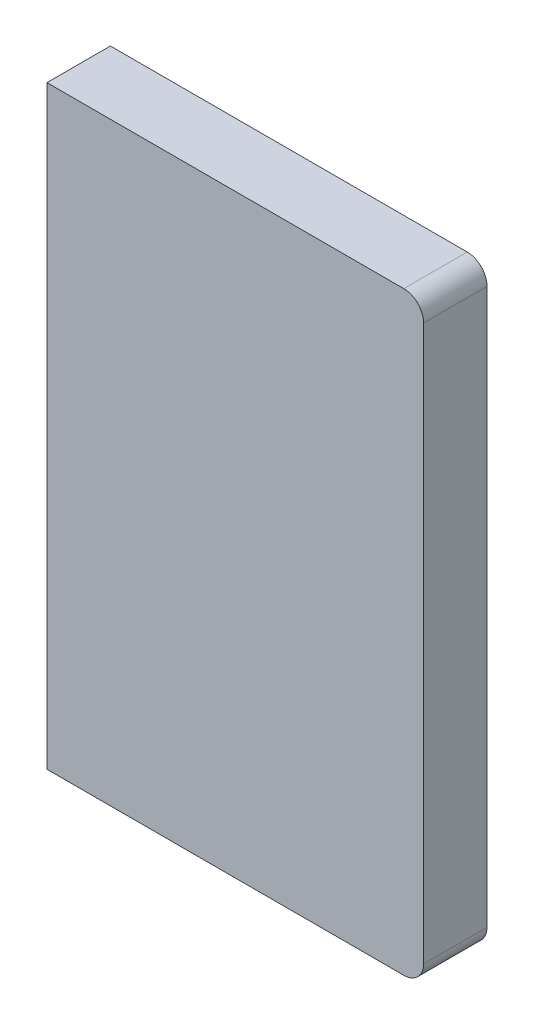
from build123d import *

# Parameters (mm, degrees)
SKETCH1_W           = 95
SKETCH1_H           = 150
BOSS_EXTRUDE1_DEPTH = 16
FILLET1_R           = 5


with BuildPart() as part:
    # Sketch1 → Boss-Extrude1 (new body)
    with BuildSketch(Plane.XY):
        with Locations((23.47693227, 28.735795388)):
            Rectangle(SKETCH1_W, SKETCH1_H)
    extrude(amount=BOSS_EXTRUDE1_DEPTH)

    # Fillet1
    fillet1_edges = [part.edges().sort_by_distance(p)[0] for p in [
        (70.97693227, 103.735795388, 8),
        (70.97693227, -46.264204612, 8),
    ]]
    fillet(fillet1_edges, radius=FILLET1_R)


solid = part.part
